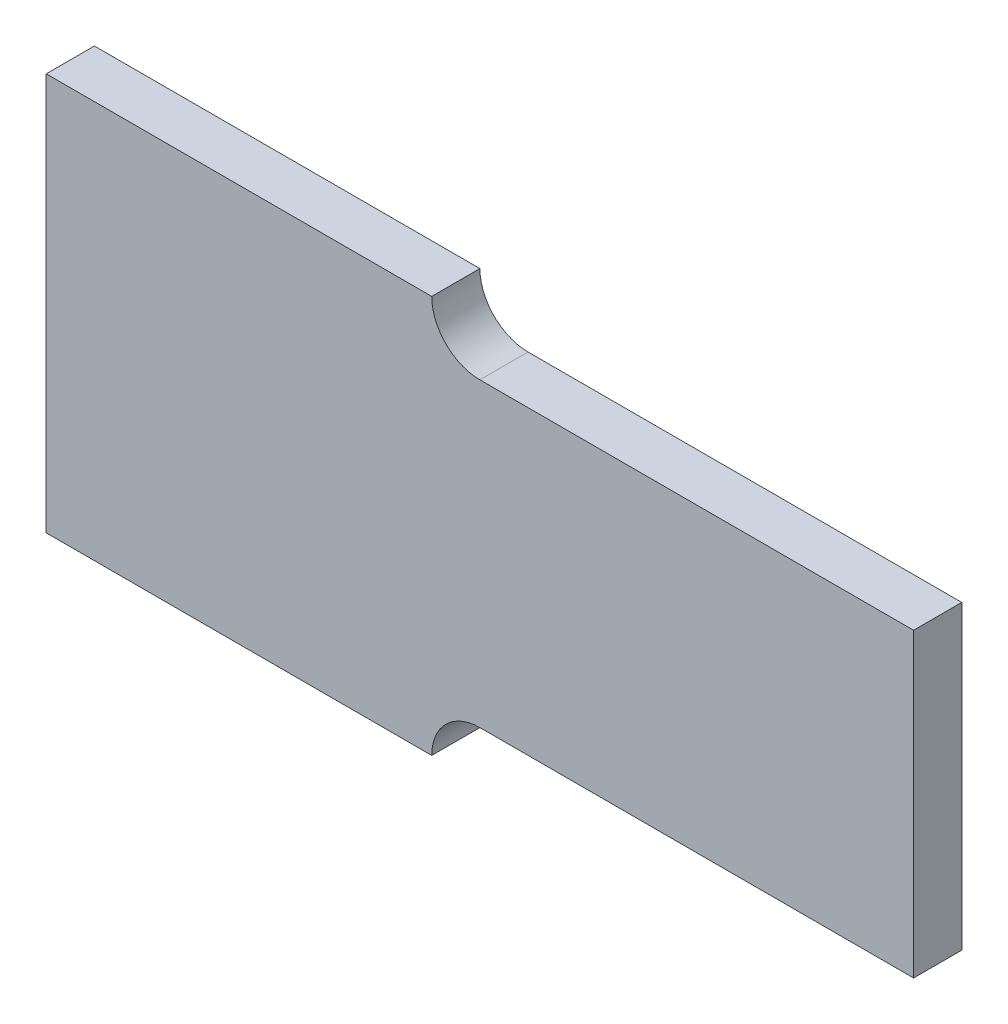
from build123d import *

# Parameters (mm, degrees)
BOSS_EXTRUDE1_DEPTH = 12.7


with BuildPart() as part:
    # Sketch1 → Boss-Extrude1 (new body)
    with BuildSketch(Plane.XY):
        with BuildLine():
            Line((101.6, 104.775), (0, 104.775))
            Line((0, 104.775), (0, 0))
            Line((0, 0), (101.6, 0))
            ThreePointArc((101.6, 0), (105.319743879, 8.980256121), (114.3, 12.7))
            Line((114.3, 12.7), (228.6, 12.7))
            Line((228.6, 12.7), (228.6, 92.075))
            Line((228.6, 92.075), (114.3, 92.075))
            ThreePointArc((114.3, 92.075), (105.319743879, 95.794743879), (101.6, 104.775))
        make_face()
    extrude(amount=BOSS_EXTRUDE1_DEPTH)


solid = part.part
